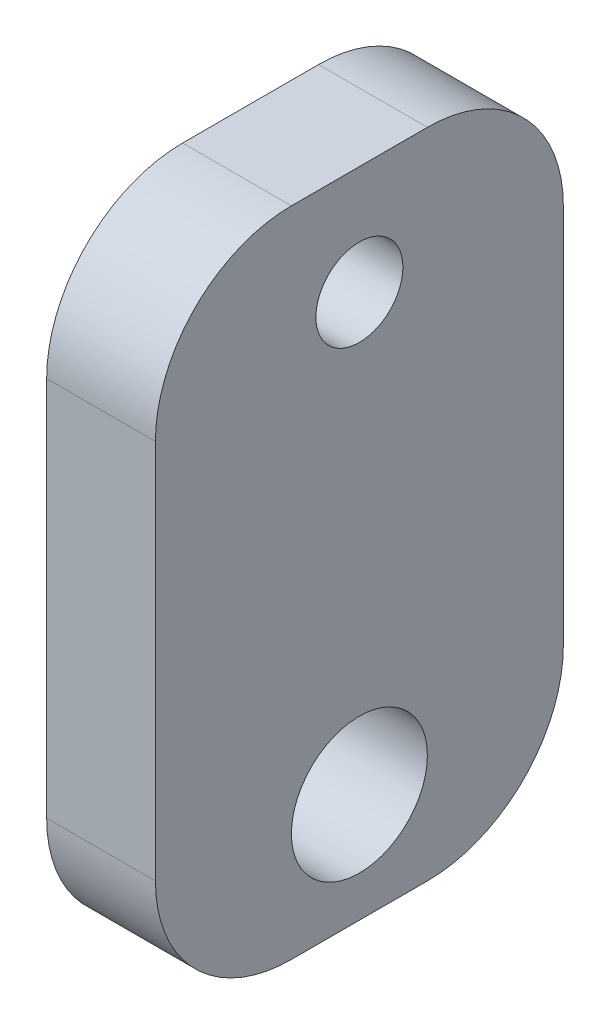
from build123d import *

# Parameters (mm, degrees)
SKETCH1_W           = 15
SKETCH1_H           = 24
BOSS_EXTRUDE1_DEPTH = 4
SKETCH2_R           = 2.5
SKETCH2_R_2         = 1.6
CUT_EXTRUDE1_DEPTH  = 29.583211856
FILLET1_R           = 5


with BuildPart() as part:
    # Sketch1 → Boss-Extrude1 (new body)
    with BuildSketch(Plane(origin=(0, 0, 0), x_dir=(0, 0, -1), z_dir=(1, 0, 0))):
        with Locations((7.5, -12)):
            Rectangle(SKETCH1_W, SKETCH1_H)
    extrude(amount=BOSS_EXTRUDE1_DEPTH)

    # Sketch2 → Cut-Extrude1 (cut, through all)
    with BuildSketch(Plane(origin=(4, 0, 0), x_dir=(0, 0, -1), z_dir=(1, 0, 0))):
        with Locations((7.5, -20)):
            Circle(SKETCH2_R)
        with Locations((7.5, -4)):
            Circle(SKETCH2_R_2)
    extrude(amount=-CUT_EXTRUDE1_DEPTH, mode=Mode.SUBTRACT)

    # Fillet1
    fillet1_edges = [part.edges().sort_by_distance(p)[0] for p in [
        (2, 0, 0),
        (2, 0, -15),
        (2, -24, -15),
        (2, -24, 0),
    ]]
    fillet(fillet1_edges, radius=FILLET1_R)


solid = part.part
